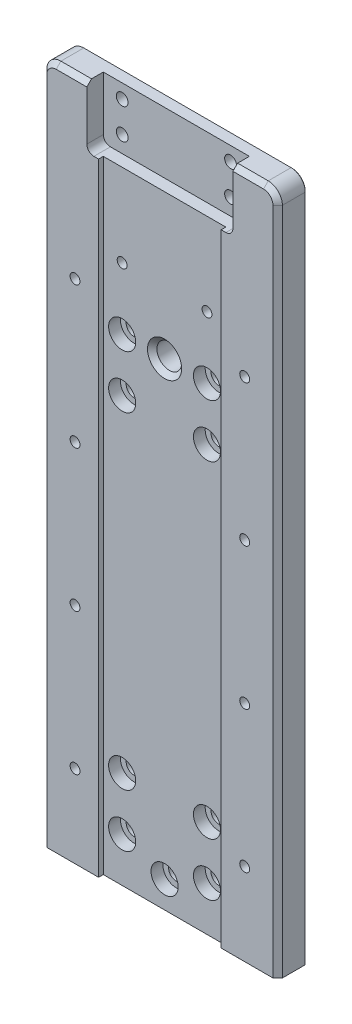
from build123d import *

# Parameters (mm, degrees)
SKETCH1_W               = 100
SKETCH1_H               = 290
BOSS_EXTRUDE1_DEPTH     = 6
SKETCH2_W               = 62
SKETCH2_H               = 26
CUT_EXTRUDE1_DEPTH      = 7
SKETCH3_W               = 52
SKETCH3_H               = 290
CUT_EXTRUDE2_DEPTH      = 2
SKETCH4_R               = 2.5
SKETCH4_R_2             = 5.25
SKETCH4_R_3             = 2.1
SKETCH4_R_4             = 3.3
CUT_EXTRUDE_HOLES_DEPTH = 21
FILLET1_R               = 3
FILLET2_R               = 6
CHAMFER1_SIZE           = 2
SKETCH5_R               = 5.75
CUT_EXTRUDE5_DEPTH      = 5
CHAMFER2_SIZE           = 2
CHAMFER3_SIZE           = 0.3


with BuildPart() as part:
    # Sketch1 → Boss-Extrude1 (new, symmetric)
    with BuildSketch(Plane.XY):
        Rectangle(SKETCH1_W, SKETCH1_H)
    extrude(amount=BOSS_EXTRUDE1_DEPTH, both=True)

    # Sketch2 → Cut-Extrude1 (cut)
    with BuildSketch(Plane.XY.offset(6)):
        with Locations((0, 132)):
            Rectangle(SKETCH2_W, SKETCH2_H)
    extrude(amount=-CUT_EXTRUDE1_DEPTH, mode=Mode.SUBTRACT)

    # Sketch3 → Cut-Extrude2 (cut)
    with BuildSketch(Plane.XY.offset(6)):
        Rectangle(SKETCH3_W, SKETCH3_H)
    extrude(amount=-CUT_EXTRUDE2_DEPTH, mode=Mode.SUBTRACT)

    # Sketch4 → Cut-Extrude HOLES (cut)
    with BuildSketch(Plane.XY.offset(-6)):
        with Locations((-23, 139)):
            Circle(SKETCH4_R)
        with Locations((23, 139)):
            Circle(SKETCH4_R)
        with Locations((23, 126)):
            Circle(SKETCH4_R)
        with Locations((-23, 126)):
            Circle(SKETCH4_R)
        with Locations(Location((0, 57.59, 0), (0, 0, 180))):
            Circle(SKETCH4_R_2)
        with Locations(Location((-18, 83.89, 0), (0, 0, 180))):
            Circle(SKETCH4_R_3)
        with Locations(Location((-18, 57.59, 0), (0, 0, 180))):
            Circle(SKETCH4_R_4)
        with Locations(Location((-18, 35.09, 0), (0, 0, 180))):
            Circle(SKETCH4_R_4)
        with Locations((-36, 70)):
            Circle(SKETCH4_R_3)
        with Locations((-36, 10)):
            Circle(SKETCH4_R_3)
        with Locations((-36, -110)):
            Circle(SKETCH4_R_3)
        with Locations((-36, -50)):
            Circle(SKETCH4_R_3)
        with Locations(Location((-18, -103.65, 0), (0, 0, 180))):
            Circle(SKETCH4_R_4)
        with Locations(Location((-18, -126.15, 0), (0, 0, 180))):
            Circle(SKETCH4_R_4)
        with Locations(Location((18, -103.65, 0), (0, 0, 180))):
            Circle(SKETCH4_R_4)
        with Locations(Location((18, -126.15, 0), (0, 0, 180))):
            Circle(SKETCH4_R_4)
        with Locations(Location((0, -133.65, 0), (0, 0, 180))):
            Circle(SKETCH4_R_4)
        with Locations(Location((36, 70, 0), (0, 0, 180))):
            Circle(SKETCH4_R_3)
        with Locations(Location((18, 83.89, 0), (0, 0, 180))):
            Circle(SKETCH4_R_3)
        with Locations(Location((18, 35.09, 0), (0, 0, 180))):
            Circle(SKETCH4_R_4)
        with Locations(Location((18, 57.59, 0), (0, 0, 180))):
            Circle(SKETCH4_R_4)
        with Locations(Location((36, 10, 0), (0, 0, 180))):
            Circle(SKETCH4_R_3)
        with Locations(Location((36, -50, 0), (0, 0, 180))):
            Circle(SKETCH4_R_3)
        with Locations(Location((36, -110, 0), (0, 0, 180))):
            Circle(SKETCH4_R_3)
    extrude(amount=CUT_EXTRUDE_HOLES_DEPTH, mode=Mode.SUBTRACT)

    # Fillet1
    fillet1_edges = [part.edges().sort_by_distance(p)[0] for p in [
        (-31, 119, 2.5),
        (31, 119, 2.5),
    ]]
    fillet(fillet1_edges, radius=FILLET1_R)

    # Fillet2
    fillet2_edges = [part.edges().sort_by_distance(p)[0] for p in [
        (-50, 145, 0),
        (50, 145, 0),
    ]]
    fillet(fillet2_edges, radius=FILLET2_R)

    # Chamfer1
    chamfer1_edges = [part.edges().sort_by_distance(p)[0] for p in [
        (50, -3, 6),
        (-37.5, 145, 6),
        (37.5, 145, 6),
        (48.242640687, 143.242640687, 6),
        (-50, -3, 6),
        (-48.242640687, 143.242640687, 6),
    ]]
    chamfer(chamfer1_edges, length=CHAMFER1_SIZE)

    # Sketch5 → Cut-Extrude5 (cut)
    with BuildSketch(Plane.XY.offset(4)):
        with Locations((-18, 57.59)):
            Circle(SKETCH5_R)
        with Locations((-18, 35.09)):
            Circle(SKETCH5_R)
        with Locations((18, 35.09)):
            Circle(SKETCH5_R)
        with Locations((18, 57.59)):
            Circle(SKETCH5_R)
        with Locations((18, -103.65)):
            Circle(SKETCH5_R)
        with Locations((-18, -103.65)):
            Circle(SKETCH5_R)
        with Locations((-18, -126.15)):
            Circle(SKETCH5_R)
        with Locations((0, -133.65)):
            Circle(SKETCH5_R)
        with Locations((18, -126.15)):
            Circle(SKETCH5_R)
    extrude(amount=-CUT_EXTRUDE5_DEPTH, mode=Mode.SUBTRACT)

    # Chamfer2
    chamfer2_edges = [part.edges().sort_by_distance(p)[0] for p in [
        (5.25, 57.59, 4),
    ]]
    chamfer(chamfer2_edges, length=CHAMFER2_SIZE)

    # Chamfer3
    chamfer3_edges = [part.edges().sort_by_distance(p)[0] for p in [
        (0, 145, -6),
        (-50, -3, -6),
        (-48.242640687, 143.242640687, -6),
        (48.242640687, 143.242640687, -6),
        (50, -3, -6),
    ]]
    chamfer(chamfer3_edges, length=CHAMFER3_SIZE)


solid = part.part
